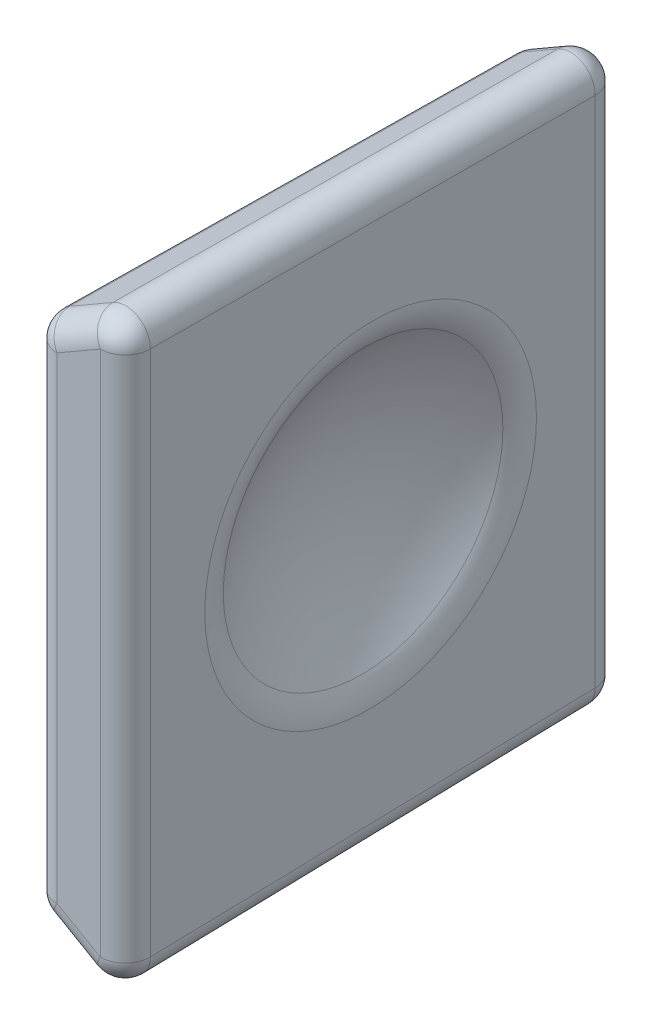
from build123d import *

# Parameters (mm, degrees)
BOSS_EXTRUDE1_DEPTH = 20
BOSS_EXTRUDE1_DRAFT = -0.5
FILLET1_R           = 1
FILLET2_R           = 2


with BuildPart() as part:
    # Sketch1 → Boss-Extrude1 (with draft: the straight prism first)
    with BuildSketch(Plane.XY):
        Polygon((0, 12.020725942), (-3.750114229, 9.855596483), (-3.750114229, -10.432946752), (0, -12.598076211), align=None)
    extrude(amount=-BOSS_EXTRUDE1_DEPTH)
    # Boss-Extrude1: the draft: its side faces are tilted about the plane it starts from
    boss_extrude1_sides = [part.faces().sort_by_distance(p)[0] for p in [
        (-1.875057114, 10.938161212, -10),
        (-3.750114229, -0.288675135, -10),
        (-1.875057114, -11.515511482, -10),
        (0, -0.288675135, -10),
    ]]
    draft(boss_extrude1_sides, Plane.XY, BOSS_EXTRUDE1_DRAFT)

    # Fillet1
    fillet1_edges = [part.edges().sort_by_distance(p)[0] for p in [
        (-1.875057114, 10.736622834, -20),
        (-3.575576873, -0.288675135, -20),
        (-1.875057114, -11.313973103, -20),
        (-3.750114229, -0.288675135, 0),
        (-1.875057114, 10.938161212, 0),
        (0, -0.288675135, 0),
        (-1.875057114, -11.515511482, 0),
        (-3.662845551, -10.382562157, -10),
        (-3.662845551, 9.805211888, -10),
        (-0.087268678, 11.869572158, -10),
        (-0.087268678, -12.446922427, -10),
        (-0.174537356, -0.288675135, -20),
    ]]
    fillet(fillet1_edges, radius=FILLET1_R)

    # Sketch2 → Cut-Revolve1 (revolve, cut)
    with BuildSketch(Plane(origin=(0, 0, 0), x_dir=(1, 0, 0), z_dir=(0, 1, 0))):
        with BuildLine():
            Line((8.726833455, 10.000724303), (8.726833455, -0.726109151))
            ThreePointArc((8.726833455, -0.726109151), (16.311850131, 2.415707627), (19.453666909, 10.000724303))
            ThreePointArc((19.453666909, 10.000724303), (16.311850131, 17.58574098), (8.726833455, 20.727557758))
            Line((8.726833455, 20.727557758), (8.726833455, 10.000724303))
        make_face()
    revolve(axis=Axis((8.726833455, 0, -20.727557758), (0, 0, 1)), mode=Mode.SUBTRACT)

    # Fillet2
    fillet2_edges = [part.edges().sort_by_distance(p)[0] for p in [
        (-0.139958798, 0, -16.037689693),
    ]]
    fillet(fillet2_edges, radius=FILLET2_R)


solid = part.part
